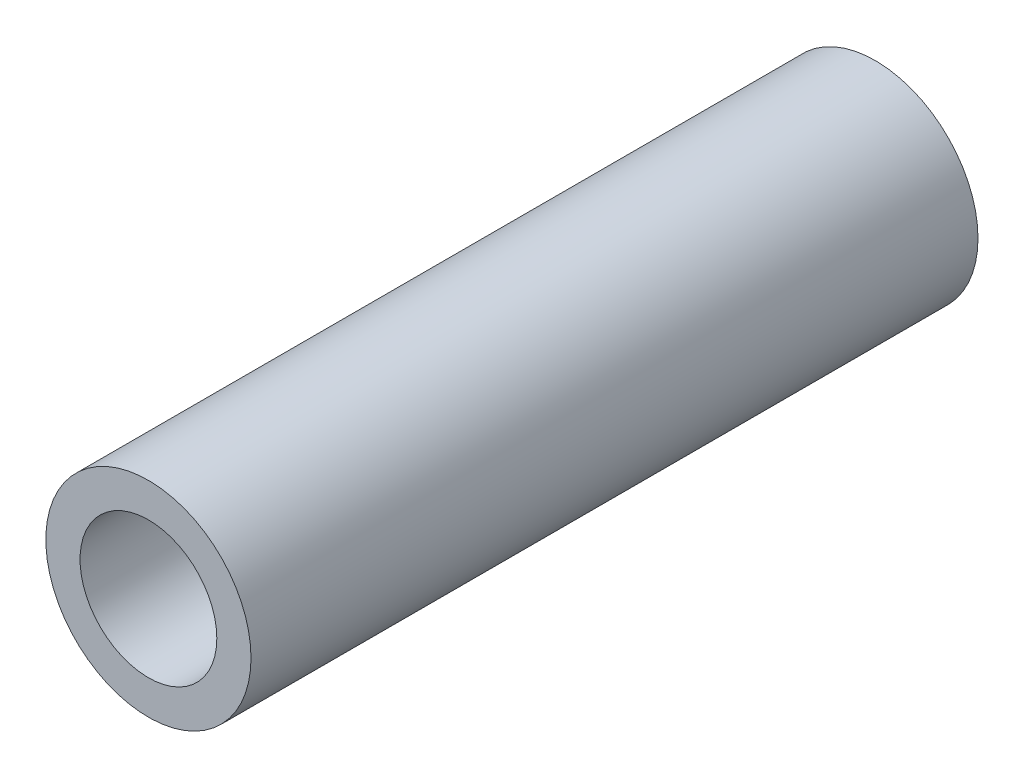
from build123d import *

# Parameters (mm, degrees)
SZKIC1_R                    = 15
SZKIC1_R_2                  = 10
DODANIE_WYCI_GNI_CIE1_DEPTH = 53.15


with BuildPart() as part:
    # Szkic1 → Dodanie-wyciągnięcie1 (new, symmetric)
    with BuildSketch(Plane.XY):
        Circle(SZKIC1_R)
        Circle(SZKIC1_R_2, mode=Mode.SUBTRACT)
    extrude(amount=DODANIE_WYCI_GNI_CIE1_DEPTH, both=True)


solid = part.part
